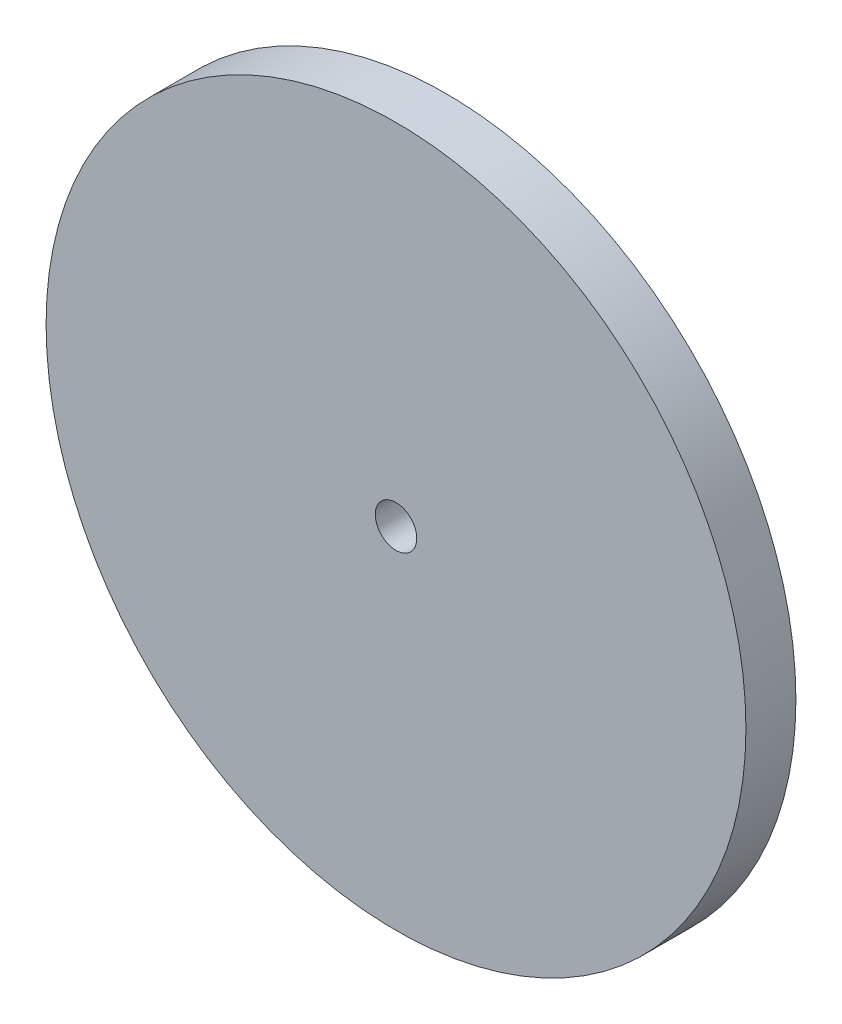
from build123d import *

# Parameters (mm, degrees)
CROQUIS1_R              = 35
SALIENTE_EXTRUIR1_DEPTH = 5
CROQUIS2_R              = 2.075
CORTAR_EXTRUIR1_DEPTH   = 50.749371855


with BuildPart() as part:
    # Croquis1 → Saliente-Extruir1 (new body)
    with BuildSketch(Plane.XY):
        Circle(CROQUIS1_R)
    extrude(amount=SALIENTE_EXTRUIR1_DEPTH)

    # Croquis2 → Cortar-Extruir1 (cut, through all)
    with BuildSketch(Plane(origin=(0, 0, 0), x_dir=(-1, 0, 0), z_dir=(0, 0, -1))):
        Circle(CROQUIS2_R)
    extrude(amount=-CORTAR_EXTRUIR1_DEPTH, mode=Mode.SUBTRACT)


solid = part.part
